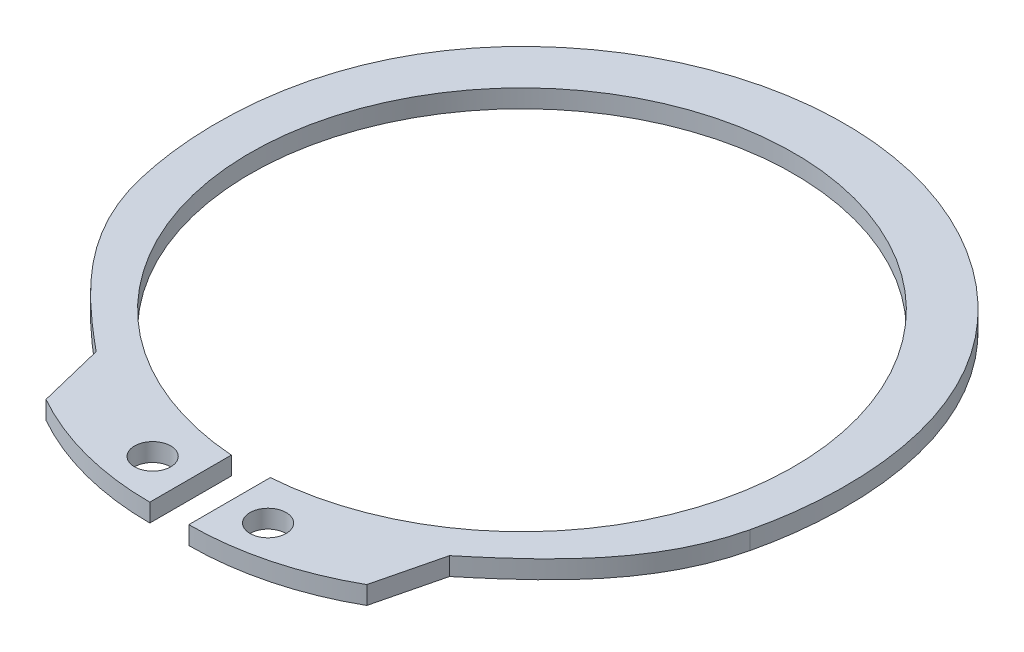
from build123d import *

# Parameters (mm, degrees)
IZIM1_R                     = 2
Y_KSEKLIK_EKSTR_ZYON1_DEPTH = 2


with BuildPart() as part:
    # Çizim1 → Yükseklik-Ekstrüzyon1 (new body)
    # profile 1 of 2: a face of its own
    with BuildSketch(Plane(origin=(0, 0, 0), x_dir=(1, 0, 0), z_dir=(0, 1, 0))):
        with BuildLine():
            Line((-2.151853537, -38.922725918), (-2.151853537, -29.922725918))
            ThreePointArc((-2.151853537, -29.922725918), (-29.980675255, 1.076620282), (0, 30))
            Line((0, 30), (0, 35.6))
            ThreePointArc((0, 35.6), (-13.229776272, 33.050461718), (-24.564618776, 25.767023584))
            add(Edge.make_bspline(
                [(-24.564618776, 25.767023584), (-32.251007767, 18.439315954), (-35.719007685, 6.21673721), (-34.276517941, -5.541694008), (-33.608104639, -8.414682353)],
                knots=[0, 0, 0, 0, 0.765438226, 1, 1, 1, 1], degree=3))
            add(Edge.make_bspline(
                [(-33.608104639, -8.414682353), (-31.608167264, -17.010855942), (-25.43277753, -22.569195675), (-19.499413864, -27.49500702)],
                knots=[0, 0, 0, 0, 1, 1, 1, 1], degree=3))
            Line((-19.499413864, -27.49500702), (-17.70199444, -34.827578129))
            ThreePointArc((-17.70199444, -34.827578129), (-10.192020163, -37.881778178), (-2.151853537, -38.922725918))
        make_face()
        with Locations(Location((-6.368896391, -34.390315296, 0), (0, 0, 270))):
            Circle(IZIM1_R, mode=Mode.SUBTRACT)
    # profile 2 of 2: a face of its own
    with BuildSketch(Plane(origin=(0, 0, 0), x_dir=(1, 0, 0), z_dir=(0, 1, 0))):
        with BuildLine():
            ThreePointArc((6.368896391, -29.316158663), (4.271156259, -29.694397185), (2.151853537, -29.922725918))
            Line((2.151853537, -29.922725918), (2.151853537, -38.922725918))
            ThreePointArc((2.151853537, -38.922725918), (10.192020163, -37.881778178), (17.70199444, -34.827578129))
            Line((17.70199444, -34.827578129), (19.499413864, -27.49500702))
            add(Edge.make_bspline(
                [(33.608104639, -8.414682353), (31.608167264, -17.010855942), (25.43277753, -22.569195675), (19.499413864, -27.49500702)],
                knots=[0, 0, 0, 0, 1, 1, 1, 1], degree=3))
            add(Edge.make_bspline(
                [(24.564618776, 25.767023584), (32.251007767, 18.439315954), (35.719007685, 6.21673721), (34.276517941, -5.541694008), (33.608104639, -8.414682353)],
                knots=[0, 0, 0, 0, 0.765438226, 1, 1, 1, 1], degree=3))
            ThreePointArc((24.564618776, 25.767023584), (13.229776272, 33.050461718), (0, 35.6))
            Line((0, 35.6), (0, 30))
            ThreePointArc((0, 30), (21.213203436, 21.213203436), (30, 0))
            ThreePointArc((30, 0), (23.356657421, -18.827282176), (6.368896391, -29.316158663))
        make_face()
        with Locations(Location((6.368896391, -34.390315296, 0), (0, 0, 270))):
            Circle(IZIM1_R, mode=Mode.SUBTRACT)
    extrude(amount=Y_KSEKLIK_EKSTR_ZYON1_DEPTH)


solid = part.part
